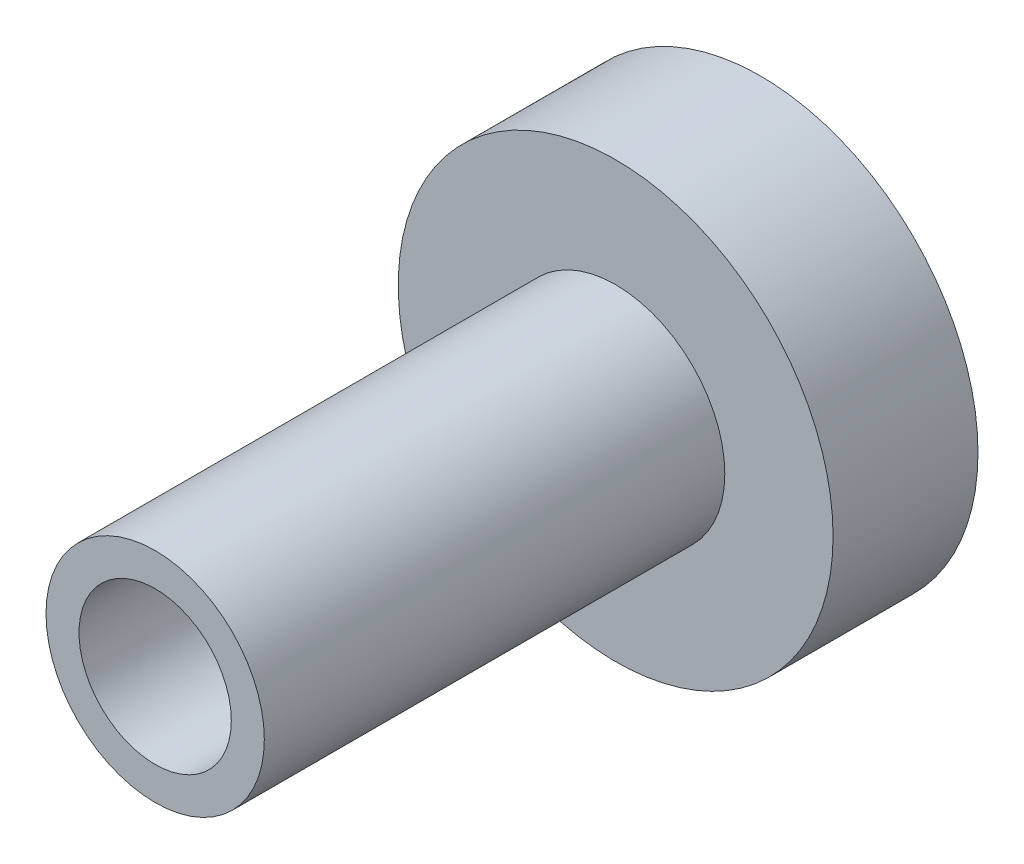
from build123d import *

# Parameters (mm, degrees)
SKETCH1_R           = 11.85
SKETCH1_R_2         = 4.15
BOSS_EXTRUDE1_DEPTH = 33
CUT_EXTRUDE1_START  = -25.1
SKETCH2_R           = 11.85
SKETCH2_R_2         = 5.95
CUT_EXTRUDE1_DEPTH  = 25.1


with BuildPart() as part:
    # Sketch1 → Boss-Extrude1 (new body)
    with BuildSketch(Plane.XY):
        Circle(SKETCH1_R)
        Circle(SKETCH1_R_2, mode=Mode.SUBTRACT)
    extrude(amount=BOSS_EXTRUDE1_DEPTH)

    # Sketch2 → Cut-Extrude1 (cut)
    with BuildSketch(Plane.XY.offset(33).offset(CUT_EXTRUDE1_START)):
        Circle(SKETCH2_R)
        Circle(SKETCH2_R_2, mode=Mode.SUBTRACT)
    extrude(amount=CUT_EXTRUDE1_DEPTH, mode=Mode.SUBTRACT)


solid = part.part
